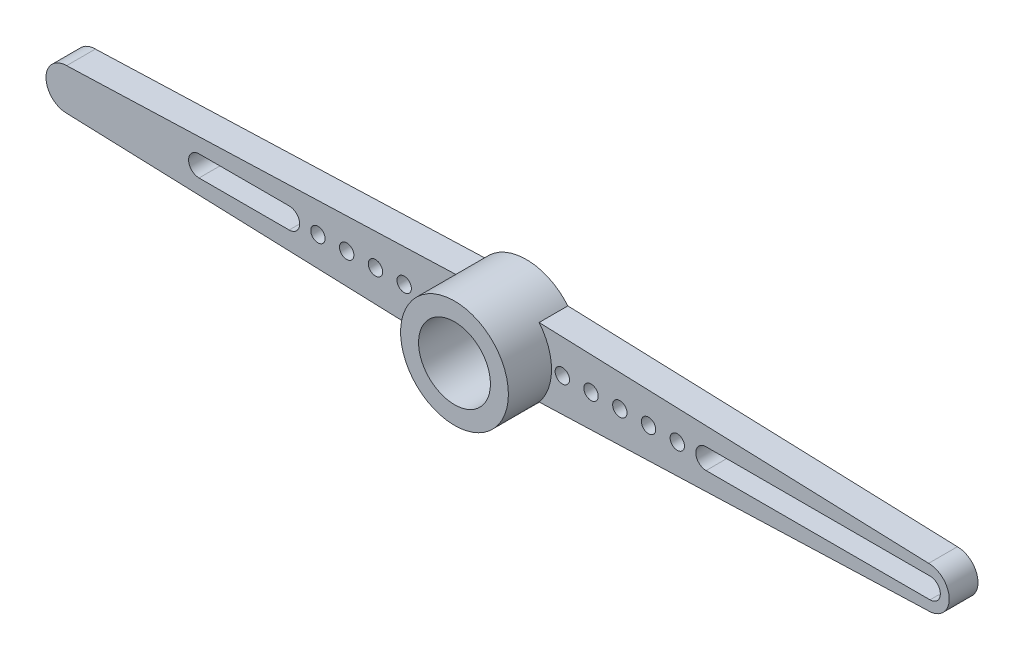
from build123d import *

# Parameters (mm, degrees)
EXTRUDE_3_DEPTH     = 2
EXTRUDE_3_2_DEPTH   = 2
SKETCH_2_R          = 3.75
SKETCH_2_R_2        = 2.5
EXTRUDE_5_DEPTH     = 3
EXTRUDE_START       = 2
SKETCH_3_R          = 3.75
SKETCH_3_R_2        = 2.5
EXTRUDE_6_DEPTH     = 2
SKETCH_4_R          = 0.5
CUT_EXTRUDE_1_DEPTH = 2
SKETCH_5_R          = 2.5
EXTRUDE_7_DEPTH     = 1
SKETCH_6_R          = 2.5
CUT_EXTRUDE_2_DEPTH = 0.5
SKETCH_7_R          = 1.25
CUT_EXTRUDE_3_DEPTH = 5
CUT_EXTRUDE2_DEPTH  = 2


with BuildPart() as part:
    # Эскиз1 → Бобышка-Вытянуть3 (new body)
    with BuildSketch(Plane.XY):
        with BuildLine():
            ThreePointArc((-2.88547071, -2.395111434), (-3.527252129, -1.273182005), (-3.75, 0))
            ThreePointArc((-3.75, 0), (-3.527252129, 1.273182005), (-2.88547071, 2.395111434))
            Line((-2.88547071, 2.395111434), (-29.981181912, 1.434943796))
            ThreePointArc((-29.981181912, 1.434943796), (-31.416125708, 0), (-29.981181912, -1.434943796))
            Line((-29.981181912, -1.434943796), (-2.88547071, -2.395111434))
        make_face()
    extrude(amount=EXTRUDE_3_DEPTH)



with BuildPart() as body_2:
    # Эскиз1 → Extrude 3 2 (new body)
    with BuildSketch(Plane.XY):
        with BuildLine():
            Line((29.981181912, 1.434943796), (2.88547071, 2.395111434))
            ThreePointArc((2.88547071, 2.395111434), (3.75, 0), (2.88547071, -2.395111434))
            Line((2.88547071, -2.395111434), (29.981181912, -1.434943796))
            ThreePointArc((29.981181912, -1.434943796), (31.416125708, 0), (29.981181912, 1.434943796))
        make_face()
    extrude(amount=EXTRUDE_3_2_DEPTH)


with BuildPart() as body_3:
    # Эскиз2 → Бобышка-Вытянуть5 (new body)
    with BuildSketch(Plane.XY.offset(2)):
        Circle(SKETCH_2_R)
        Circle(SKETCH_2_R_2, mode=Mode.SUBTRACT)
    extrude(amount=EXTRUDE_5_DEPTH)


with BuildPart() as part_1:
    add(part.part)

    add(body_2.part)  # Бобышка-Вытянуть6 merges body 2

    add(body_3.part)  # Бобышка-Вытянуть6 merges body 3
    # Эскиз3 → Бобышка-Вытянуть6 (add)
    with BuildSketch(Plane(origin=(0, 0, 2), x_dir=(-1, 0, 0), z_dir=(0, 0, -1)).offset(EXTRUDE_START)):
        with Locations(Location((0, 0, 0), (0, 0, 180))):
            Circle(SKETCH_3_R)
        with Locations(Location((0, 0, 0), (0, 0, 180))):
            Circle(SKETCH_3_R_2, mode=Mode.SUBTRACT)
    extrude(amount=-EXTRUDE_6_DEPTH)

    # Эскиз4 → Вырез-Вытянуть1 (cut)
    with BuildSketch(Plane(origin=(0, 0, 0), x_dir=(-1, 0, 0), z_dir=(0, 0, -1))):
        with Locations((-14.5, 0)):
            Circle(SKETCH_4_R)
        with Locations((-4.5, 0)):
            Circle(SKETCH_4_R)
        with Locations((-6.5, 0)):
            Circle(SKETCH_4_R)
        with Locations((-8.5, 0)):
            Circle(SKETCH_4_R)
        with Locations((-10.5, 0)):
            Circle(SKETCH_4_R)
        with Locations((-12.5, 0)):
            Circle(SKETCH_4_R)
        with Locations((4.5, 0)):
            Circle(SKETCH_4_R)
        with Locations((6.5, 0)):
            Circle(SKETCH_4_R)
        with Locations((8.5, 0)):
            Circle(SKETCH_4_R)
        with Locations((10.5, 0)):
            Circle(SKETCH_4_R)
        with Locations((12.5, 0)):
            Circle(SKETCH_4_R)
        with Locations((14.5, 0)):
            Circle(SKETCH_4_R)
    extrude(amount=-CUT_EXTRUDE_1_DEPTH, mode=Mode.SUBTRACT)

    # Эскиз5 → Бобышка-Вытянуть7 (add)
    with BuildSketch(Plane(origin=(0, 0, 0), x_dir=(-1, 0, 0), z_dir=(0, 0, -1))):
        with Locations(Location((0, 0, 0), (0, 0, 180))):
            Circle(SKETCH_5_R)
    extrude(amount=-EXTRUDE_7_DEPTH)

    # Эскиз6 → Вырез-Вытянуть2 (cut)
    with BuildSketch(Plane(origin=(0, 0, 0), x_dir=(-1, 0, 0), z_dir=(0, 0, -1))):
        with Locations(Location((0, 0, 0), (0, 0, 180))):
            Circle(SKETCH_6_R)
    extrude(amount=-CUT_EXTRUDE_2_DEPTH, mode=Mode.SUBTRACT)

    # Эскиз7 → Вырез-Вытянуть3 (cut)
    with BuildSketch(Plane(origin=(0, 0, 0.5), x_dir=(-1, 0, 0), z_dir=(0, 0, -1))):
        Circle(SKETCH_7_R)
    extrude(amount=-CUT_EXTRUDE_3_DEPTH, mode=Mode.SUBTRACT)

    # Sketch3 → Cut-Extrude2 (cut)
    with BuildSketch(Plane(origin=(0, 0, 0), x_dir=(-1, 0, 0), z_dir=(0, 0, -1))):
        with BuildLine():
            Line((20.770262951, -0.726731665), (14.5, -0.726731665))
            ThreePointArc((14.5, -0.726731665), (13.773268335, 0), (14.5, 0.726731665))
            Line((14.5, 0.726731665), (20.770262951, 0.726731665))
            ThreePointArc((20.770262951, 0.726731665), (21.496994893, 2.77e-07), (20.770262951, -0.726731665))
        make_face()
        with BuildLine():
            Line((-14.5, -0.716032824), (-30.079105353, -0.716032824))
            ThreePointArc((-30.079105353, -0.716032824), (-30.795138177, 0), (-30.079105353, 0.716032824))
            Line((-30.079105353, 0.716032824), (-14.5, 0.716032824))
            ThreePointArc((-14.5, 0.716032824), (-13.783967176, 0), (-14.5, -0.716032824))
        make_face()
    extrude(amount=-CUT_EXTRUDE2_DEPTH, mode=Mode.SUBTRACT)


solid = part_1.part
